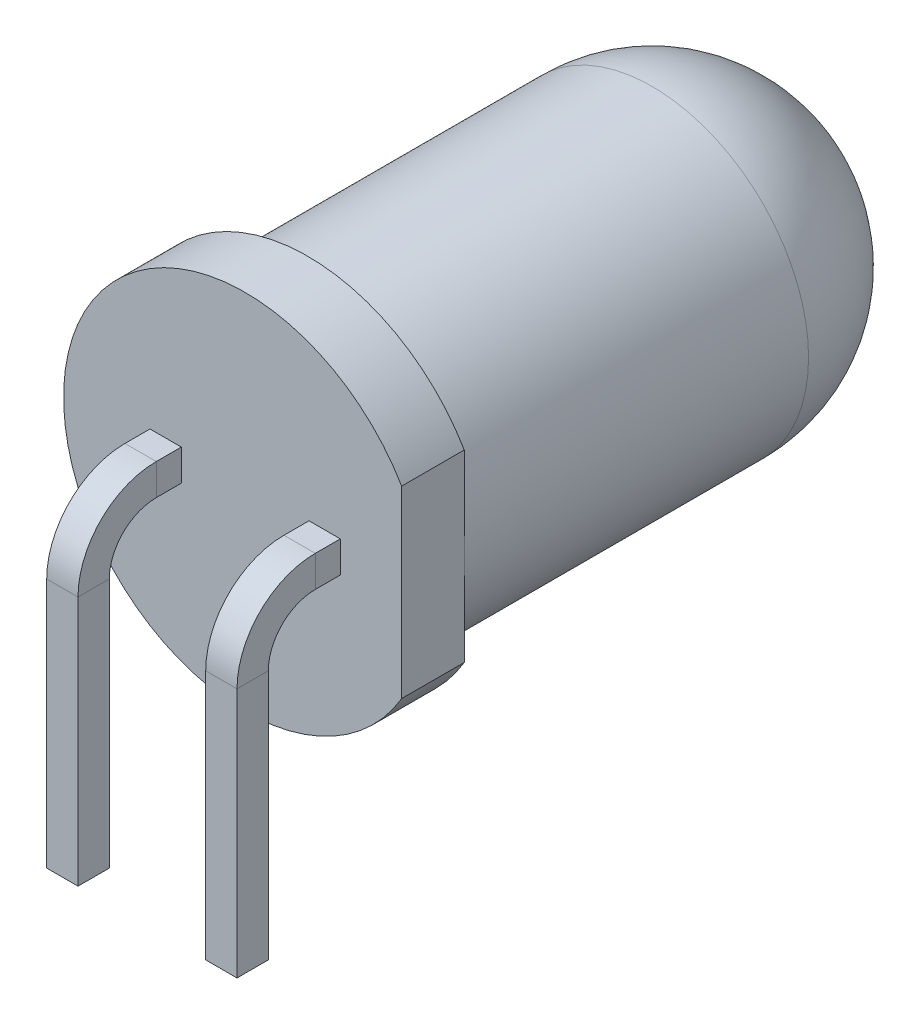
from build123d import *

# Parameters (mm, degrees)
SKETCH2_W          = 0.4
SKETCH2_H          = 2.939387692
CUT_EXTRUDE1_DEPTH = 10.890399385
SKETCH3_W          = 0.5
SKETCH3_H          = 0.5


with BuildPart() as part:
    # Sketch1 → Revolve1 (revolve)
    with BuildSketch(Plane(origin=(0, 0, 0), x_dir=(1, 0, 0), z_dir=(0, 1, 0))):
        with BuildLine():
            Line((0, 0), (0, 9))
            ThreePointArc((0, 9), (1.767766953, 8.267766953), (2.5, 6.5))
            Line((2.5, 6.5), (2.5, 1))
            Line((2.5, 1), (2.9, 1))
            Line((2.9, 1), (2.9, 0))
            Line((2.9, 0), (0, 0))
        make_face()
    revolve(axis=Axis((0, 0, 0), (0, 0, -1)))

    # Sketch2 → Cut-Extrude1 (cut, through all)
    with BuildSketch(Plane.XY):
        with Locations((2.7, 0)):
            Rectangle(SKETCH2_W, SKETCH2_H)
    extrude(amount=-CUT_EXTRUDE1_DEPTH, mode=Mode.SUBTRACT)

    # Sweep1: sweep along a path in Sketch4
    with BuildLine(Plane(origin=(1.27, 0, 0), x_dir=(0, 0, -1), z_dir=(1, 0, 0))) as sweep1_path:
        Line((0, 0), (-0.4, 0))
        ThreePointArc((-0.4, 0), (-1.107106781, -0.292893219), (-1.4, -1))
        Line((-1.4, -1), (-1.4, -5))
    # Sketch3 → Sweep1 (sweep)
    with BuildSketch(Plane.XY):
        with Locations((-1.27, 0)):
            Rectangle(SKETCH3_W, SKETCH3_H)
        with Locations((1.27, 0)):
            Rectangle(SKETCH3_W, SKETCH3_H)
    sweep(path=sweep1_path.line)


solid = part.part
